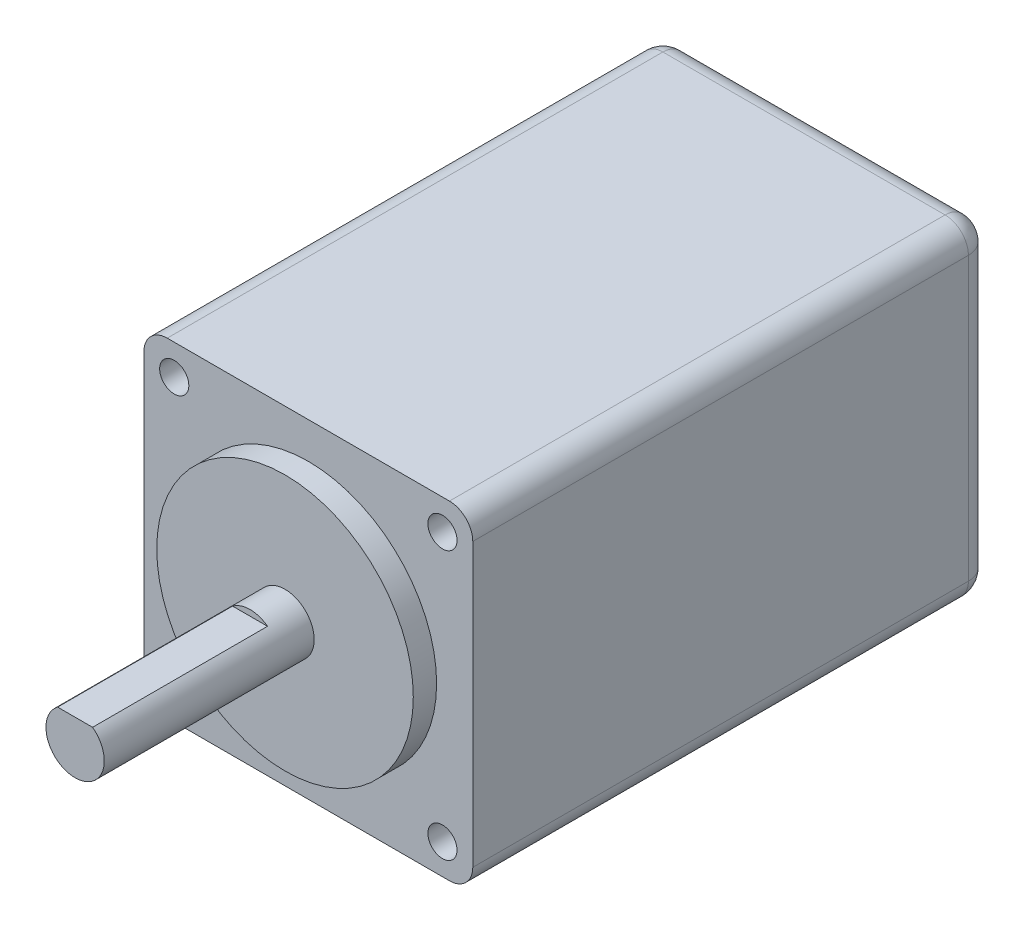
from build123d import *

# Parameters (mm, degrees)
SKETCH1_W           = 28.2
SKETCH1_H           = 28.2
BOSS_EXTRUDE1_DEPTH = 44.5
SKETCH2_R           = 11
BOSS_EXTRUDE2_DEPTH = 2
SKETCH3_R           = 2.5
BOSS_EXTRUDE3_DEPTH = 18
SKETCH4_W           = 15
SKETCH4_H           = 0.5
CUT_EXTRUDE1_DEPTH  = 5
SKETCH5_R           = 1.25
CUT_EXTRUDE2_DEPTH  = 2.5
FILLET1_R           = 2


with BuildPart() as part:
    # Sketch1 → Boss-Extrude1 (new body)
    with BuildSketch(Plane.XY):
        Rectangle(SKETCH1_W, SKETCH1_H)
    extrude(amount=BOSS_EXTRUDE1_DEPTH)

    # Sketch2 → Boss-Extrude2 (add)
    with BuildSketch(Plane.XY.offset(44.5)):
        with Locations(Location((0, 0, 0), (0, 0, 180))):
            Circle(SKETCH2_R)
    extrude(amount=BOSS_EXTRUDE2_DEPTH)

    # Sketch3 → Boss-Extrude3 (add)
    with BuildSketch(Plane.XY.offset(46.5)):
        Circle(SKETCH3_R)
    extrude(amount=BOSS_EXTRUDE3_DEPTH)

    # Sketch4 → Cut-Extrude1 (cut, symmetric)
    with BuildSketch(Plane(origin=(0, 0, 0), x_dir=(0, 0, -1), z_dir=(1, 0, 0))):
        with Locations((-57, 2.25)):
            Rectangle(SKETCH4_W, SKETCH4_H)
    extrude(amount=CUT_EXTRUDE1_DEPTH, both=True, mode=Mode.SUBTRACT)

    # Sketch5 → Cut-Extrude2 (cut)
    with BuildSketch(Plane.XY.offset(44.5)):
        with Locations((-11.5, 11.5)):
            Circle(SKETCH5_R)
        with Locations((11.5, 11.5)):
            Circle(SKETCH5_R)
        with Locations((11.5, -11.5)):
            Circle(SKETCH5_R)
        with Locations((-11.5, -11.5)):
            Circle(SKETCH5_R)
    extrude(amount=-CUT_EXTRUDE2_DEPTH, mode=Mode.SUBTRACT)

    # Fillet1
    fillet1_edges = [part.edges().sort_by_distance(p)[0] for p in [
        (0, -14.1, 0),
        (-14.1, 0, 0),
        (0, 14.1, 0),
        (14.1, 0, 0),
        (14.1, -14.1, 22.25),
        (-14.1, -14.1, 22.25),
        (-14.1, 14.1, 22.25),
        (14.1, 14.1, 22.25),
    ]]
    fillet(fillet1_edges, radius=FILLET1_R)


solid = part.part
